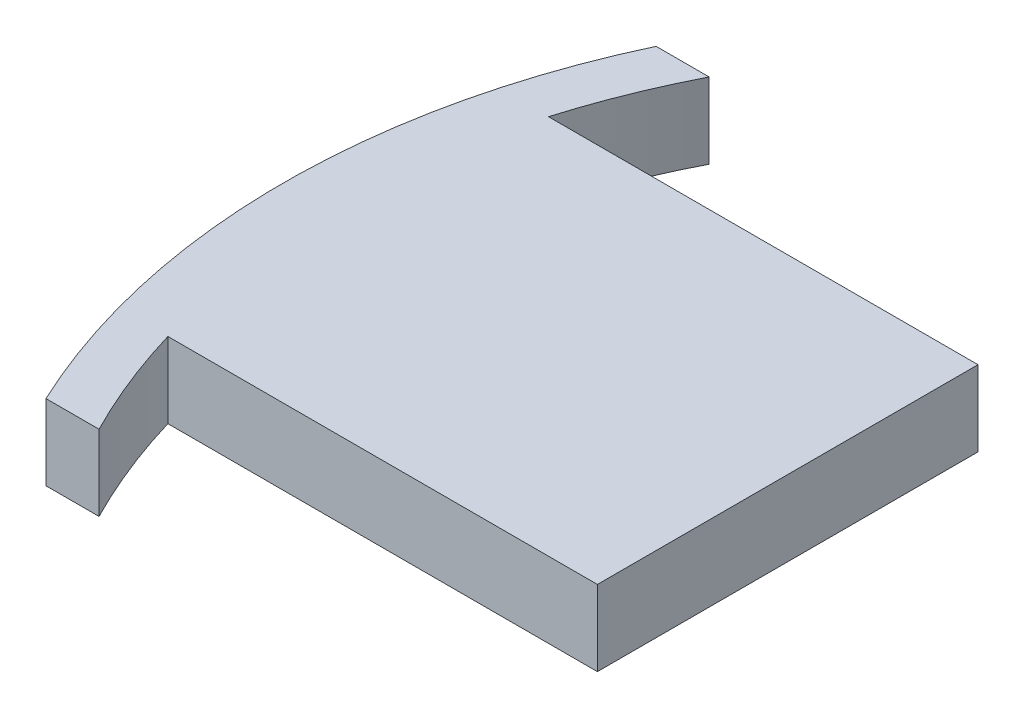
from build123d import *

# Parameters (mm, degrees)
BOSS_EXTRUDE2_DEPTH = 1.975


with BuildPart() as part:
    # Sketch1 → Boss-Extrude2 (new body)
    with BuildSketch(Plane(origin=(0, 0, 0), x_dir=(1, 0, 0), z_dir=(0, 1, 0))):
        with BuildLine():
            ThreePointArc((-16.969439443, 7.975), (-18.75, 0), (-16.969439443, -7.975))
            Line((-16.969439443, -7.975), (-15.582823878, -7.975))
            ThreePointArc((-15.582823878, -7.975), (-16.252359809, -6.502755234), (-16.783158225, -4.975))
            Line((-16.783158225, -4.975), (-5.555, -4.975))
            Line((-5.555, -4.975), (-5.555, 4.975))
            Line((-5.555, 4.975), (-16.783158225, 4.975))
            ThreePointArc((-16.783158225, 4.975), (-16.252359809, 6.502755234), (-15.582823878, 7.975))
            Line((-15.582823878, 7.975), (-16.969439443, 7.975))
        make_face()
    extrude(amount=BOSS_EXTRUDE2_DEPTH)


solid = part.part
